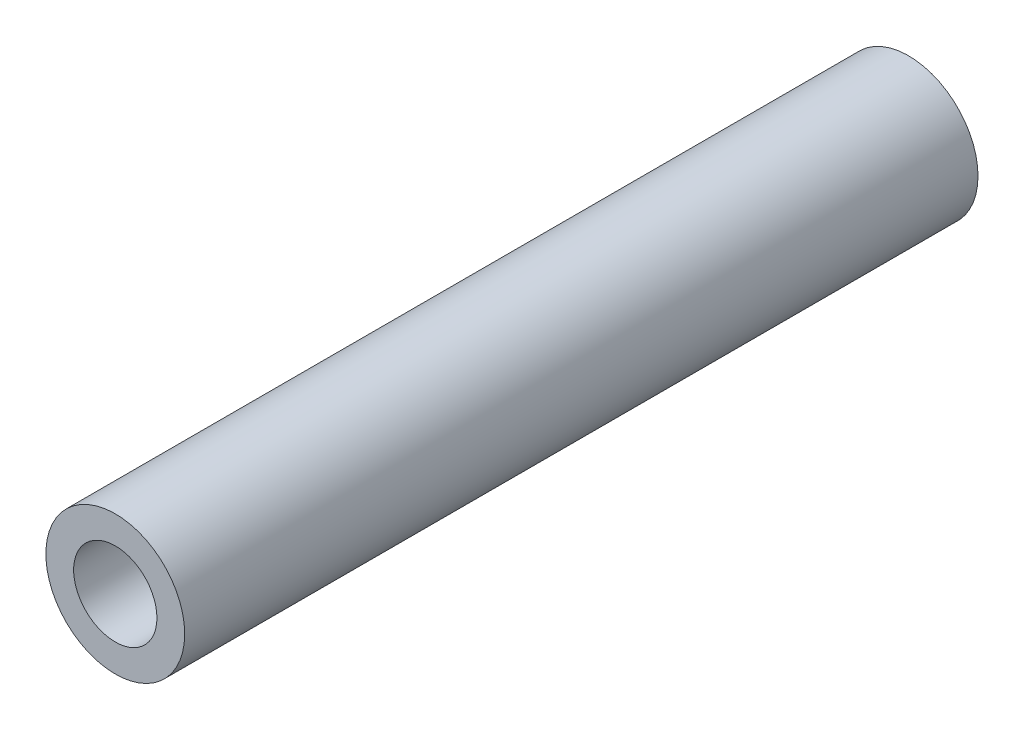
from build123d import *

# Parameters (mm, degrees)
SKETCH1_R           = 3.5
SKETCH1_R_2         = 2.1
BOSS_EXTRUDE1_DEPTH = 40


with BuildPart() as part:
    # Sketch1 → Boss-Extrude1 (new body)
    with BuildSketch(Plane.XY):
        with Locations((-93.848562649, 33.512423495)):
            Circle(SKETCH1_R)
        with Locations((-93.848562649, 33.512423495)):
            Circle(SKETCH1_R_2, mode=Mode.SUBTRACT)
    extrude(amount=BOSS_EXTRUDE1_DEPTH)


solid = part.part
